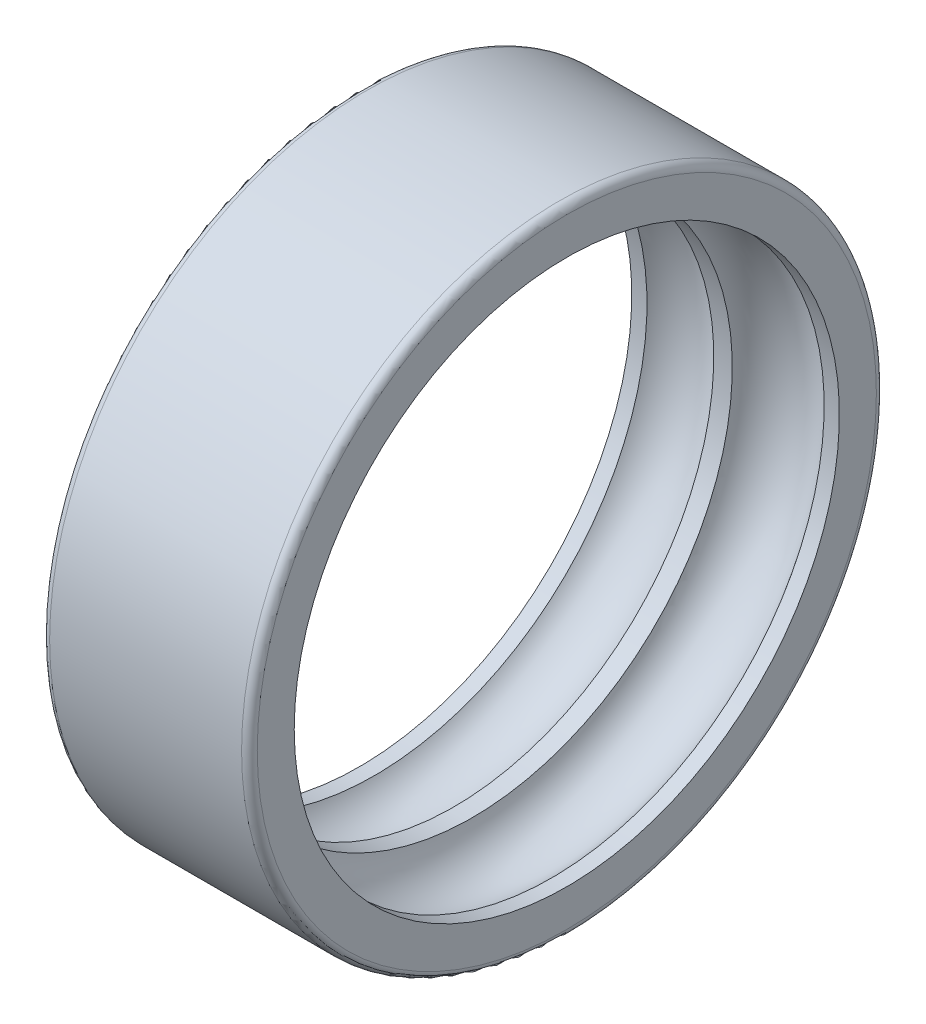
from build123d import *


with BuildPart() as part:
    # Schizzo1 → Rivoluzione1 (revolve)
    with BuildSketch(Plane.XY, mode=Mode.PRIVATE) as rivoluzione1_sk:
        with BuildLine():
            Line((0, 82.9), (0, 73))
            Line((0, 73), (4.075173742, 73))
            ThreePointArc((4.075173742, 73), (15.761127456, 78.034636074), (25.321314712, 69.6375))
            Line((25.321314712, 69.6375), (30.278685288, 69.6375))
            ThreePointArc((30.278685288, 69.6375), (39.838872544, 78.034636074), (51.524826258, 73))
            Line((51.524826258, 73), (55.6, 73))
            Line((55.6, 73), (55.6, 82.9))
            ThreePointArc((55.6, 82.9), (54.98492424, 84.38492424), (53.5, 85))
            Line((53.5, 85), (2.1, 85))
            ThreePointArc((2.1, 85), (0.61507576, 84.38492424), (0, 82.9))
        make_face()
    revolve(rivoluzione1_sk.sketch.rotate(Axis((27.8, 0, 0), (-1, 0, 0)), 270), axis=Axis((27.8, 0, 0), (-1, 0, 0)))


solid = part.part
